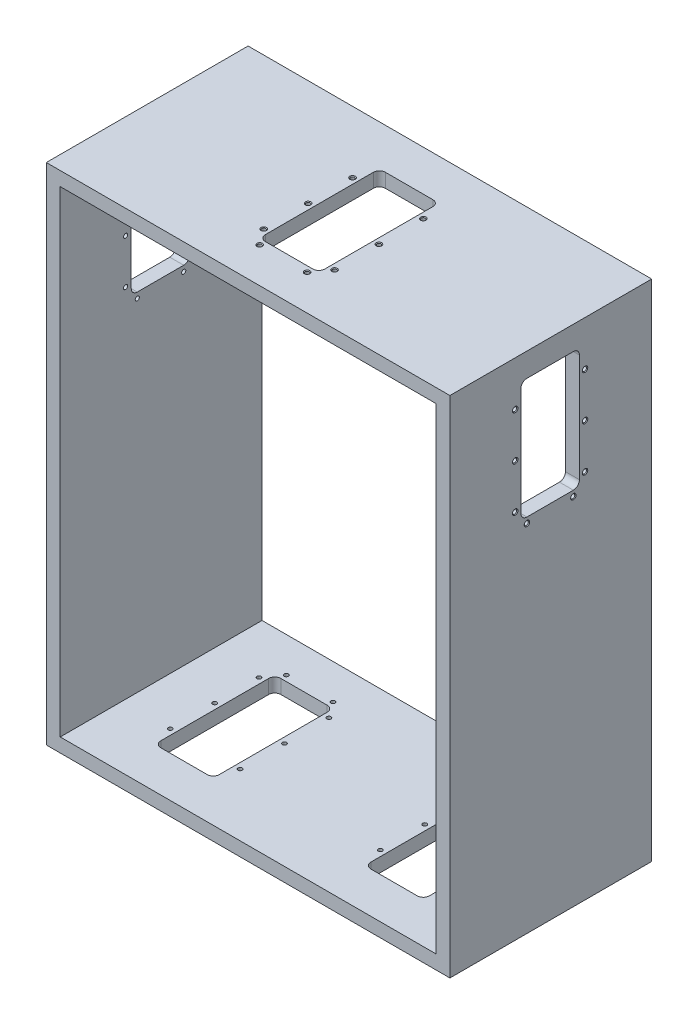
from build123d import *

# Parameters (mm, degrees)
ESBO_O1_W                  = 200
ESBO_O1_H                  = 250
RESSALTO_EXTRUS_O2_DEPTH   = 100
ESBO_O6_W                  = 186.2
ESBO_O6_H                  = 236.2
CORTE_EXTRUS_O3_DEPTH      = 100
ESBO_O7_W                  = 29
ESBO_O7_H                  = 59.5
CORTE_EXTRUS_O4_DEPTH      = 213
FILETE1_R                  = 3
CORTE_EXTRUS_O6_DEPTH      = 189.745860882
CORTE_EXTRUS_O6_DEPTH_BACK = 189.745860882
ESBO_O8_R                  = 1.025
CHANFRO2_SIZE              = 0.325
CHANFRO3_SIZE              = 0.325
ESBO_O10_W                 = 29.5
ESBO_O10_H                 = 59.5
CORTE_EXTRUS_O7_DEPTH      = 47
FILETE2_R                  = 3
ESBO_O11_R                 = 1.025
CORTE_EXTRUS_O8_DEPTH      = 9
CHANFRO4_SIZE              = 0.325
ESBO_O12_W                 = 29
ESBO_O12_H                 = 59.5
CORTE_EXTRUS_O9_DEPTH      = 23
FILETE3_R                  = 3
ESBO_O13_R                 = 1.025
CORTE_EXTRUS_O10_DEPTH     = 23
CHANFRO5_SIZE              = 0.325


with BuildPart() as part:
    # Esboço1 → Ressalto-extrusão2 (new body)
    with BuildSketch(Plane.XY):
        Rectangle(ESBO_O1_W, ESBO_O1_H)
    extrude(amount=RESSALTO_EXTRUS_O2_DEPTH)

    # Esboço6 → Corte-extrusão3 (cut)
    with BuildSketch(Plane(origin=(0, 0, 0), x_dir=(-1, 0, 0), z_dir=(0, 0, -1))):
        Rectangle(ESBO_O6_W, ESBO_O6_H)
    extrude(amount=-CORTE_EXTRUS_O3_DEPTH, mode=Mode.SUBTRACT)

    # Esboço7 → Corte-extrusão4 (cut)
    with BuildSketch(Plane(origin=(100, 0, 0), x_dir=(0, 0, -1), z_dir=(1, 0, 0))):
        with Locations((-50.318421244, 83.522264674)):
            Rectangle(ESBO_O7_W, ESBO_O7_H)
    extrude(amount=-CORTE_EXTRUS_O4_DEPTH, mode=Mode.SUBTRACT)

    # Filete1
    filete1_edges = [part.edges().sort_by_distance(p)[0] for p in [
        (-96.55, 53.772264674, 64.818421244),
        (96.55, 53.772264674, 64.818421244),
        (-96.55, 113.272264674, 64.818421244),
        (96.55, 113.272264674, 64.818421244),
        (-96.55, 113.272264674, 35.818421244),
        (96.55, 113.272264674, 35.818421244),
        (-96.55, 53.772264674, 35.818421244),
        (96.55, 53.772264674, 35.818421244),
    ]]
    fillet(filete1_edges, radius=FILETE1_R)

    # Esboço8 → Corte-extrusão6 (cut, two sides: drawn at the far end of the back side and taken through both)
    with BuildSketch(Plane(origin=(0, 0, 0), x_dir=(0, 0, -1), z_dir=(1, 0, 0)).offset(-CORTE_EXTRUS_O6_DEPTH_BACK)):
        with Locations((-67.618421244, 102.772264674)):
            Circle(ESBO_O8_R)
        with Locations((-67.618421244, 80.772264674)):
            Circle(ESBO_O8_R)
        with Locations((-67.618421244, 58.772264674)):
            Circle(ESBO_O8_R)
        with Locations((-61.818421244, 50.972264674)):
            Circle(ESBO_O8_R)
        with Locations(Location((-38.818421244, 50.972264674, 0), (0, 0, 270))):
            Circle(ESBO_O8_R)
        with Locations(Location((-33.018421244, 58.772264674, 0), (0, 0, 270))):
            Circle(ESBO_O8_R)
        with Locations(Location((-33.018421244, 80.772264674, 0), (0, 0, 270))):
            Circle(ESBO_O8_R)
        with Locations(Location((-33.018421244, 102.772264674, 0), (0, 0, 270))):
            Circle(ESBO_O8_R)
    extrude(amount=CORTE_EXTRUS_O6_DEPTH + CORTE_EXTRUS_O6_DEPTH_BACK, mode=Mode.SUBTRACT)

    # Chanfro2
    chanfro2_edges = [part.edges().sort_by_distance(p)[0] for p in [
        (100, 103.797264674, 33.018421244),
        (100, 81.797264674, 33.018421244),
        (100, 59.797264674, 33.018421244),
        (100, 51.997264674, 38.818421244),
        (100, 50.972264674, 62.843421244),
        (100, 58.772264674, 68.643421244),
        (100, 80.772264674, 68.643421244),
        (100, 102.772264674, 68.643421244),
    ]]
    chamfer(chanfro2_edges, length=CHANFRO2_SIZE)

    # Chanfro3
    chanfro3_edges = [part.edges().sort_by_distance(p)[0] for p in [
        (-100, 103.797264674, 33.018421244),
        (-100, 81.797264674, 33.018421244),
        (-100, 59.797264674, 33.018421244),
        (-100, 51.997264674, 38.818421244),
        (-100, 50.972264674, 62.843421244),
        (-100, 58.772264674, 68.643421244),
        (-100, 80.772264674, 68.643421244),
        (-100, 102.772264674, 68.643421244),
    ]]
    chamfer(chanfro3_edges, length=CHANFRO3_SIZE)

    # Esboço10 → Corte-extrusão7 (cut)
    with BuildSketch(Plane(origin=(0, 125, 0), x_dir=(1, 0, 0), z_dir=(0, 1, 0))):
        with Locations((-0.032057976, -49.919885363)):
            Rectangle(ESBO_O10_W, ESBO_O10_H)
    extrude(amount=-CORTE_EXTRUS_O7_DEPTH, mode=Mode.SUBTRACT)

    # Filete2
    filete2_edges = [part.edges().sort_by_distance(p)[0] for p in [
        (-14.782057976, 121.55, 79.669885363),
        (-14.782057976, 121.55, 20.169885363),
        (14.717942024, 121.55, 20.169885363),
        (14.717942024, 121.55, 79.669885363),
    ]]
    fillet(filete2_edges, radius=FILETE2_R)

    # Esboço11 → Corte-extrusão8 (cut)
    with BuildSketch(Plane(origin=(0, 125, 0), x_dir=(1, 0, 0), z_dir=(0, 1, 0))):
        with Locations(Location((-17.582057976, -30.669885363, 0), (0, 0, 180))):
            Circle(ESBO_O11_R)
        with Locations(Location((-17.582057976, -52.669885363, 0), (0, 0, 180))):
            Circle(ESBO_O11_R)
        with Locations(Location((-17.582057976, -74.669885363, 0), (0, 0, 180))):
            Circle(ESBO_O11_R)
        with Locations(Location((-11.782057976, -82.469885363, 0), (0, 0, 180))):
            Circle(ESBO_O11_R)
        with Locations(Location((11.717942024, -82.469885363, 0), (0, 0, 180))):
            Circle(ESBO_O11_R)
        with Locations(Location((17.517942024, -74.669885363, 0), (0, 0, 180))):
            Circle(ESBO_O11_R)
        with Locations(Location((17.517942024, -52.669885363, 0), (0, 0, 180))):
            Circle(ESBO_O11_R)
        with Locations(Location((17.517942024, -30.669885363, 0), (0, 0, 180))):
            Circle(ESBO_O11_R)
    extrude(amount=-CORTE_EXTRUS_O8_DEPTH, mode=Mode.SUBTRACT)

    # Chanfro4
    chanfro4_edges = [part.edges().sort_by_distance(p)[0] for p in [
        (18.542942024, 125, 30.669885363),
        (18.542942024, 125, 52.669885363),
        (18.542942024, 125, 74.669885363),
        (12.742942024, 125, 82.469885363),
        (-10.757057976, 125, 82.469885363),
        (-16.557057976, 125, 74.669885363),
        (-16.557057976, 125, 52.669885363),
        (-16.557057976, 125, 30.669885363),
    ]]
    chamfer(chanfro4_edges, length=CHANFRO4_SIZE)

    # Esboço12 → Corte-extrusão9 (cut)
    with BuildSketch(Plane.XZ.offset(125)):
        with Locations((52.057675452, 49.972658861)):
            Rectangle(ESBO_O12_W, ESBO_O12_H)
        with Locations((-52.057675452, 49.972658861)):
            Rectangle(ESBO_O12_W, ESBO_O12_H)
    extrude(amount=-CORTE_EXTRUS_O9_DEPTH, mode=Mode.SUBTRACT)

    # Filete3
    filete3_edges = [part.edges().sort_by_distance(p)[0] for p in [
        (-66.557675452, -121.55, 20.222658861),
        (-66.557675452, -121.55, 79.722658861),
        (-37.557675452, -121.55, 79.722658861),
        (-37.557675452, -121.55, 20.222658861),
        (37.557675452, -121.55, 20.222658861),
        (37.557675452, -121.55, 79.722658861),
        (66.557675452, -121.55, 79.722658861),
        (66.557675452, -121.55, 20.222658861),
    ]]
    fillet(filete3_edges, radius=FILETE3_R)

    # Esboço13 → Corte-extrusão10 (cut)
    with BuildSketch(Plane.XZ.offset(125)):
        with Locations((-69.357675452, 69.222658861)):
            Circle(ESBO_O13_R)
        with Locations((-69.357675452, 47.222658861)):
            Circle(ESBO_O13_R)
        with Locations((-69.357675452, 25.222658861)):
            Circle(ESBO_O13_R)
        with Locations((-63.610686645, 17.422658861)):
            Circle(ESBO_O13_R)
        with Locations((-40.50466426, 17.422658861)):
            Circle(ESBO_O13_R)
        with Locations((-34.757675452, 25.222658861)):
            Circle(ESBO_O13_R)
        with Locations((-34.757675452, 47.222658861)):
            Circle(ESBO_O13_R)
        with Locations((-34.757675452, 69.222658861)):
            Circle(ESBO_O13_R)
        with Locations((34.757675452, 25.222658861)):
            Circle(ESBO_O13_R)
        with Locations((40.50466426, 17.422658861)):
            Circle(ESBO_O13_R)
        with Locations((63.610686645, 17.422658861)):
            Circle(ESBO_O13_R)
        with Locations((69.357675452, 25.222658861)):
            Circle(ESBO_O13_R)
        with Locations((69.357675452, 47.222658861)):
            Circle(ESBO_O13_R)
        with Locations((34.757675452, 47.222658861)):
            Circle(ESBO_O13_R)
        with Locations((34.757675452, 69.222658861)):
            Circle(ESBO_O13_R)
        with Locations((69.357675452, 69.222658861)):
            Circle(ESBO_O13_R)
    extrude(amount=-CORTE_EXTRUS_O10_DEPTH, mode=Mode.SUBTRACT)

    # Chanfro5
    chanfro5_edges = [part.edges().sort_by_distance(p)[0] for p in [
        (-35.782675452, -125, 47.222658861),
        (-35.782675452, -125, 25.222658861),
        (-41.52966426, -125, 17.422658861),
        (-64.635686645, -125, 17.422658861),
        (39.47966426, -125, 17.422658861),
        (-70.382675452, -125, 69.222658861),
        (-70.382675452, -125, 47.222658861),
        (-70.382675452, -125, 25.222658861),
        (68.332675452, -125, 69.222658861),
        (33.732675452, -125, 69.222658861),
        (33.732675452, -125, 47.222658861),
        (68.332675452, -125, 47.222658861),
        (68.332675452, -125, 25.222658861),
        (62.585686645, -125, 17.422658861),
        (-35.782675452, -125, 69.222658861),
        (33.732675452, -125, 25.222658861),
    ]]
    chamfer(chanfro5_edges, length=CHANFRO5_SIZE)


solid = part.part
